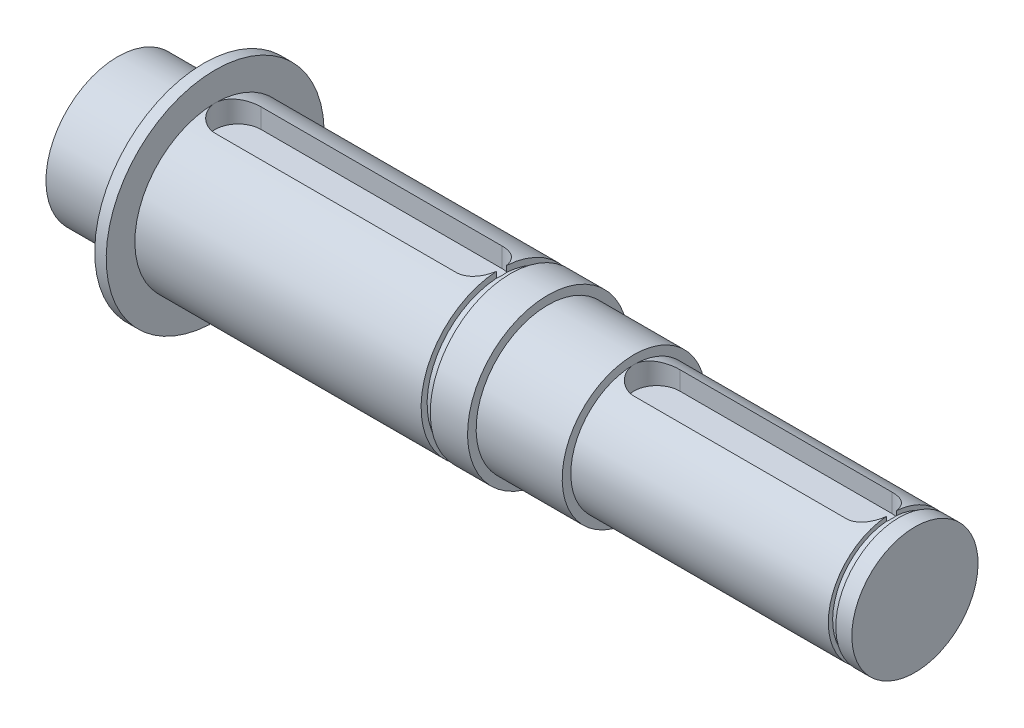
from build123d import *

# Parameters (mm, degrees)
CUT_EXTRUDE_START   = 10
CUT_EXTRUDE_1_DEPTH = 132.573302568
CUT_EXTRUDE_START_2 = 7
CUT_EXTRUDE_2_DEPTH = 135.573302568
CUT_EXTRUDE_START_3 = 68.5
SKETCH_4_R          = 14
SKETCH_4_R_2        = 12.95
CUT_EXTRUDE_3_DEPTH = 1.6
CUT_EXTRUDE_START_4 = 136.2
SKETCH_5_R          = 11
SKETCH_5_R_2        = 10.25
CUT_EXTRUDE_4_DEPTH = 1.3


with BuildPart() as part:
    # Эскиз1 → Повернуть1 (revolve)
    with BuildSketch(Plane.XY):
        Polygon((0, 0), (0, 12.5), (15, 12.5), (15, 14), (15, 19), (17, 19), (17, 14), (75, 14), (75, 12.5), (90, 12.5), (90, 11), (139, 11), (139, 0), align=None)
    revolve(axis=Axis((139, 0, 0), (-1, 0, 0)))

    # Эскиз2 → Вырез-Вытянуть1 (cut, through all)
    with BuildSketch(Plane(origin=(0, 0, 0), x_dir=(1, 0, 0), z_dir=(0, 1, 0)).offset(CUT_EXTRUDE_START)):
        with BuildLine():
            Line((21, 4), (63, 4))
            ThreePointArc((63, 4), (67, 0), (63, -4))
            Line((63, -4), (21, -4))
            ThreePointArc((21, -4), (17, 0), (21, 4))
        make_face()
    extrude(amount=CUT_EXTRUDE_1_DEPTH, mode=Mode.SUBTRACT)

    # Эскиз3 → Вырез-Вытянуть2 (cut, through all)
    with BuildSketch(Plane(origin=(0, 0, 0), x_dir=(1, 0, 0), z_dir=(0, 1, 0)).offset(CUT_EXTRUDE_START_2)):
        with BuildLine():
            Line((94, 4), (131, 4))
            ThreePointArc((131, 4), (135, 0), (131, -4))
            Line((131, -4), (94, -4))
            ThreePointArc((94, -4), (90, 0), (94, 4))
        make_face()
    extrude(amount=CUT_EXTRUDE_2_DEPTH, mode=Mode.SUBTRACT)

    # Эскиз4 → Вырез-Вытянуть3 (cut)
    with BuildSketch(Plane(origin=(0, 0, 0), x_dir=(0, 0, -1), z_dir=(1, 0, 0)).offset(CUT_EXTRUDE_START_3)):
        with Locations(Location((0, 0, 0), (0, 0, 90))):
            Circle(SKETCH_4_R)
        Circle(SKETCH_4_R_2, mode=Mode.SUBTRACT)
    extrude(amount=-CUT_EXTRUDE_3_DEPTH, mode=Mode.SUBTRACT)

    # Эскиз5 → Вырез-Вытянуть4 (cut)
    with BuildSketch(Plane(origin=(0, 0, 0), x_dir=(0, 0, -1), z_dir=(1, 0, 0)).offset(CUT_EXTRUDE_START_4)):
        with Locations(Location((0, 0, 0), (0, 0, 90))):
            Circle(SKETCH_5_R)
        Circle(SKETCH_5_R_2, mode=Mode.SUBTRACT)
    extrude(amount=-CUT_EXTRUDE_4_DEPTH, mode=Mode.SUBTRACT)


solid = part.part
